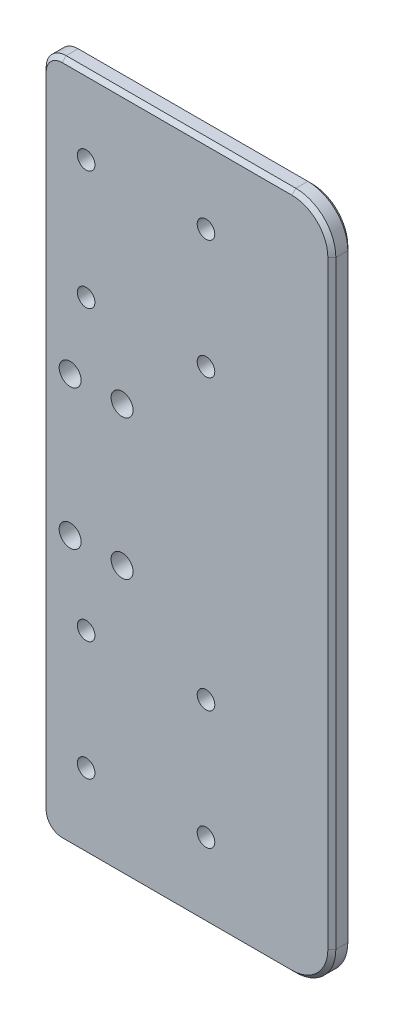
from build123d import *

# Parameters (mm, degrees)
EXTRUDE_1_DEPTH     = 5
SKETCH_4_R          = 2.2
SKETCH_4_R_2        = 2.75
CUT_EXTRUDE_1_DEPTH = 5
CHAMFER_2_SIZE      = 1


with BuildPart() as part:
    # 草图1 → 凸台-拉伸1 (new body)
    with BuildSketch(Plane.XY):
        with BuildLine():
            Line((234.824487649, -3.000003036), (234.824487649, -152.999988316))
            ThreePointArc((234.824487649, -152.999988316), (231.895556179, -160.071055409), (224.824489681, -162.999988316))
            Line((224.824489681, -162.999988316), (167.324488665, -163))
            ThreePointArc((167.324488665, -163), (163.788954102, -161.535534265), (162.324487649, -158))
            Line((162.324487649, -158), (162.324487649, 2))
            ThreePointArc((162.324487649, 2), (163.788953837, 5.535533999), (167.324487913, 7))
            Line((167.324487913, 7), (224.824488177, 6.999996964))
            ThreePointArc((224.824488177, 6.999996964), (231.895555648, 4.071064589), (234.824487649, -3.000003036))
        make_face()
    extrude(amount=-EXTRUDE_1_DEPTH)

    # 草图4 → 切除-拉伸1 (cut)
    with BuildSketch(Plane.XY):
        with Locations((203.324487649, -12.1)):
            Circle(SKETCH_4_R)
        with Locations((173.324487649, -12.1)):
            Circle(SKETCH_4_R)
        with Locations((173.324487649, -41.9)):
            Circle(SKETCH_4_R)
        with Locations((203.324487649, -41.9)):
            Circle(SKETCH_4_R)
        with Locations((173.324487649, -143.9)):
            Circle(SKETCH_4_R)
        with Locations((203.324487649, -143.9)):
            Circle(SKETCH_4_R)
        with Locations((173.324487649, -114.1)):
            Circle(SKETCH_4_R)
        with Locations((203.324487649, -114.1)):
            Circle(SKETCH_4_R)
        with Locations((169.324487649, -60.5)):
            Circle(SKETCH_4_R_2)
        with Locations((169.324487649, -95.5)):
            Circle(SKETCH_4_R_2)
        with Locations((182.324487649, -60.5)):
            Circle(SKETCH_4_R_2)
        with Locations((182.324487649, -95.5)):
            Circle(SKETCH_4_R_2)
    extrude(amount=-CUT_EXTRUDE_1_DEPTH, mode=Mode.SUBTRACT)

    # 倒角2
    chamfer_2_edges = [part.edges().sort_by_distance(p)[0] for p in [
        (196.074489173, -162.999994158, 0),
        (163.788954102, -161.535534265, 0),
        (231.895555648, 4.071064589, -5),
        (162.324487649, -78, 0),
        (163.788953837, 5.535533999, 0),
        (196.074488045, 6.999998482, 0),
        (231.895555648, 4.071064589, 0),
        (234.824487649, -77.999995676, 0),
        (196.074488045, 6.999998482, -5),
        (163.788953837, 5.535533999, -5),
        (162.324487649, -78, -5),
        (163.788954102, -161.535534265, -5),
        (196.074489173, -162.999994158, -5),
        (231.895556179, -160.071055409, -5),
        (234.824487649, -77.999995676, -5),
        (231.895556179, -160.071055409, 0),
    ]]
    chamfer(chamfer_2_edges, length=CHAMFER_2_SIZE)


solid = part.part
